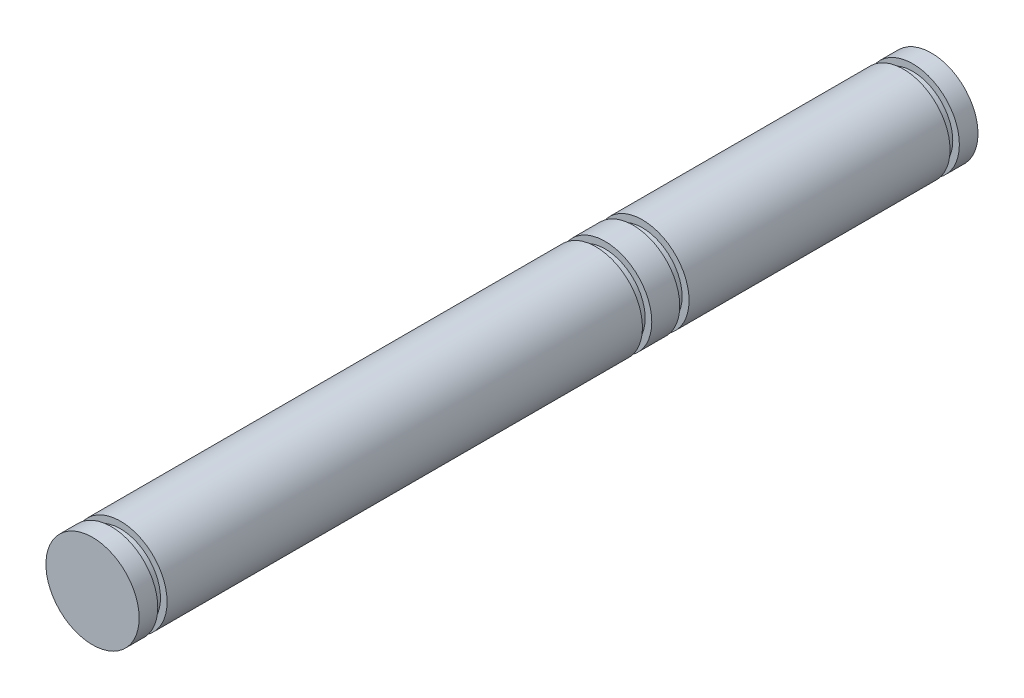
from build123d import *


with BuildPart() as part:
    # Skizze1 → Rotation1 (revolve)
    with BuildSketch(Plane(origin=(0, 0, 0), x_dir=(0, 0, -1), z_dir=(1, 0, 0)), mode=Mode.PRIVATE) as rotation1_sk:
        Polygon((-7.315845432, 0), (-7.315845432, 5), (-5.315845432, 5), (-5.315845432, 4.292030432), (-4.315845432, 4.292030432), (-4.315845432, 5), (46.684154568, 5), (46.684154568, 4.292030432), (47.684154568, 4.292030432), (47.684154568, 5), (50.684154568, 5), (50.684154568, 4.255858279), (51.684154568, 4.255858279), (51.684154568, 5), (79.684154568, 5), (79.684154568, 4.292030432), (80.684154568, 4.292030432), (80.684154568, 5), (82.684154568, 5), (82.684154568, 0), align=None)
    revolve(rotation1_sk.sketch.rotate(Axis((0, 0, 7.315845432), (0, 0, -1)), 90), axis=Axis((0, 0, 7.315845432), (0, 0, -1)))


solid = part.part
